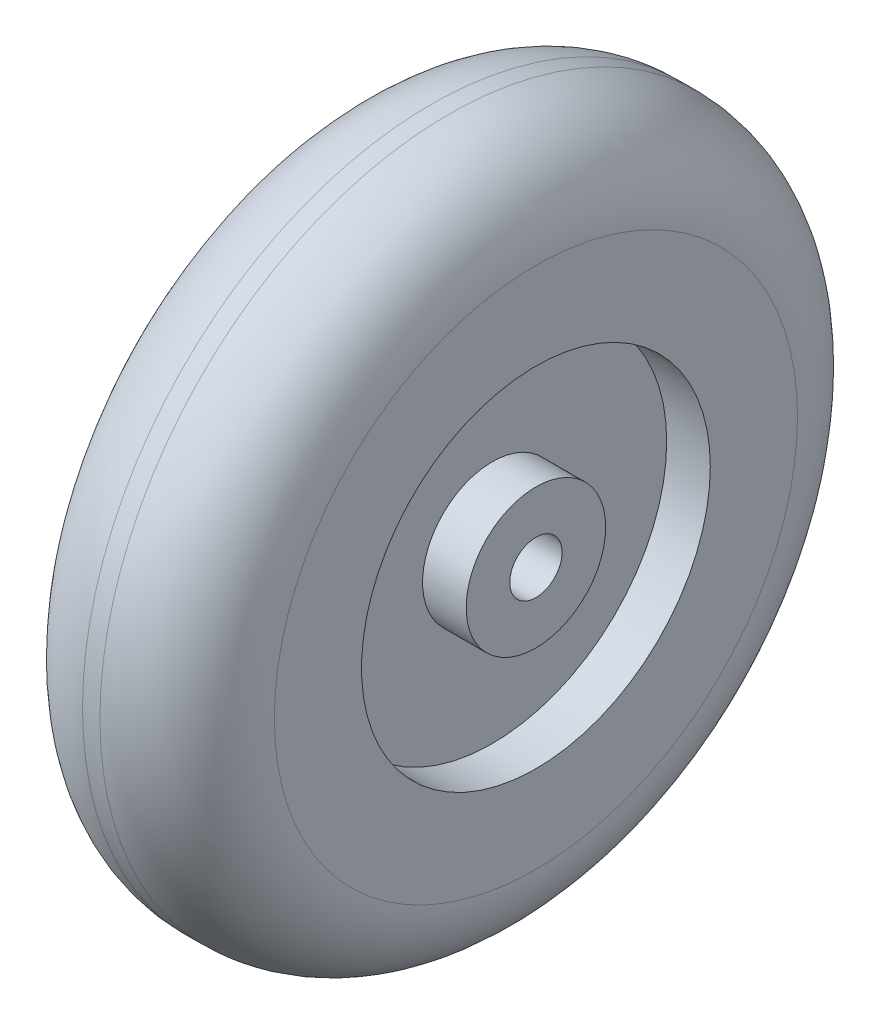
from build123d import *

# Parameters (mm, degrees)
SKETCH2_R           = 20
SKETCH2_R_2         = 1.5
BOSS_EXTRUDE1_DEPTH = 5.5
FILLET1_R           = 5
SKETCH3_R           = 10
SKETCH3_R_2         = 4
CUT_EXTRUDE1_DEPTH  = 2.5
CUT_EXTRUDE2_START  = -2.5
SKETCH4_R           = 10
SKETCH4_R_2         = 4
CUT_EXTRUDE2_DEPTH  = 2.5


with BuildPart() as part:
    # Sketch2 → Boss-Extrude1 (new, symmetric)
    with BuildSketch(Plane(origin=(0, 0, 0), x_dir=(0, 0, -1), z_dir=(1, 0, 0))):
        Circle(SKETCH2_R)
        Circle(SKETCH2_R_2, mode=Mode.SUBTRACT)
    extrude(amount=BOSS_EXTRUDE1_DEPTH, both=True)

    # Fillet1
    fillet1_edges = [part.edges().sort_by_distance(p)[0] for p in [
        (-5.5, 0, 20),
        (5.5, 0, 20),
    ]]
    fillet(fillet1_edges, radius=FILLET1_R)

    # Sketch3 → Cut-Extrude1 (cut)
    with BuildSketch(Plane(origin=(5.5, 0, 0), x_dir=(0, 0, -1), z_dir=(1, 0, 0))):
        Circle(SKETCH3_R)
        Circle(SKETCH3_R_2, mode=Mode.SUBTRACT)
    extrude(amount=-CUT_EXTRUDE1_DEPTH, mode=Mode.SUBTRACT)

    # Sketch4 → Cut-Extrude2 (cut)
    with BuildSketch(Plane.ZY.offset(5.5).offset(CUT_EXTRUDE2_START)):
        with Locations(Location((0, 0, 0), (0, 0, 180))):
            Circle(SKETCH4_R)
        with Locations(Location((0, 0, 0), (0, 0, 180))):
            Circle(SKETCH4_R_2, mode=Mode.SUBTRACT)
    extrude(amount=CUT_EXTRUDE2_DEPTH, mode=Mode.SUBTRACT)


solid = part.part
